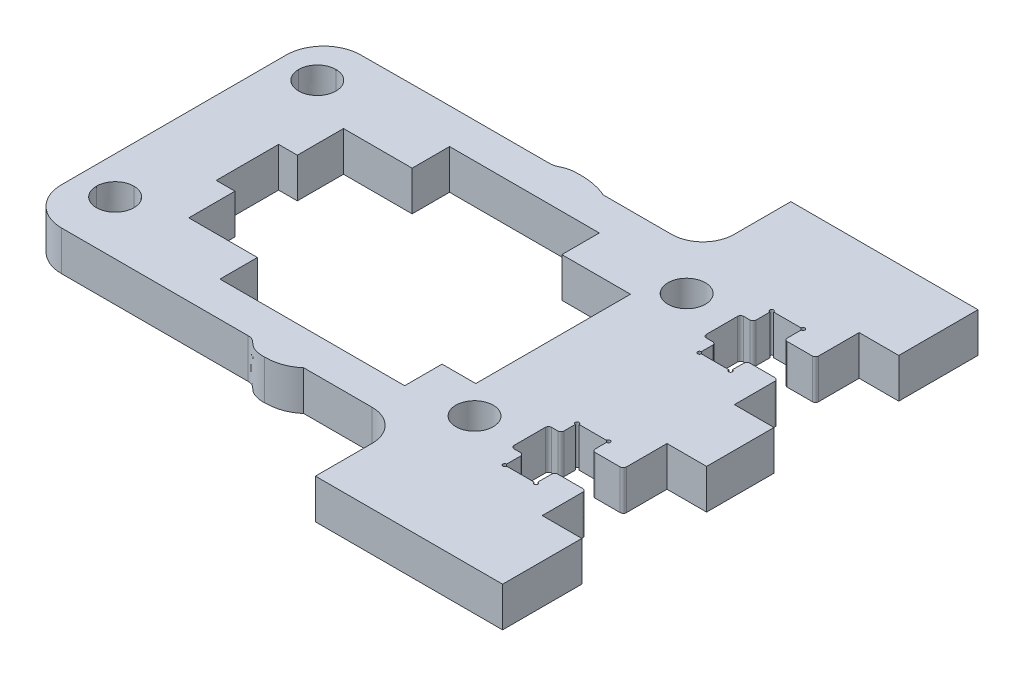
from build123d import *

# Parameters (mm, degrees)
SKETCH1_R           = 1.4998
SKETCH1_R_2         = 1.499900003
BOSS_EXTRUDE1_DEPTH = 3.175


with BuildPart() as part:
    # Sketch1 → Boss-Extrude1 (new body)
    with BuildSketch(Plane(origin=(0, 0, 0), x_dir=(1, 0, 0), z_dir=(0, 1, 0))):
        with BuildLine():
            Line((141.909960584, 37.680418232), (156.909960584, 37.680418232))
            Line((156.909960584, 37.680418232), (156.909960584, 31.330418232))
            Line((156.909960584, 31.330418232), (153.734960584, 31.330418232))
            Line((153.734960584, 31.330418232), (153.734960584, 28.080256219))
            ThreePointArc((153.734960584, 28.080256219), (153.66173728, 27.903479523), (153.484960584, 27.830256219))
            Line((153.484960584, 27.830256219), (151.484960584, 27.830256219))
            ThreePointArc((151.484960584, 27.830256219), (151.308183889, 27.903479523), (151.234960584, 28.080256219))
            Line((151.234960584, 28.080256219), (151.234960584, 29.126094713))
            Line((151.234960584, 29.126094713), (151.234960584, 29.180250843))
            ThreePointArc((151.234960584, 29.180250843), (151.341026602, 29.43631686), (151.084960584, 29.330250843))
            Line((151.084960584, 29.330250843), (150.975152963, 29.330250843))
            Line((150.975152963, 29.330250843), (148.884960584, 29.330250843))
            ThreePointArc((148.884960584, 29.330250843), (148.628894567, 29.43631686), (148.734960584, 29.180250843))
            Line((148.734960584, 29.180250843), (148.734960584, 29.126094713))
            Line((148.734960584, 29.126094713), (148.734960584, 28.080256219))
            ThreePointArc((148.734960584, 28.080256219), (148.66173728, 27.903479523), (148.484960584, 27.830256219))
            Line((148.484960584, 27.830256219), (147.984960584, 27.830256219))
            ThreePointArc((147.984960584, 27.830256219), (147.808183889, 27.757032914), (147.734960584, 27.580256219))
            Line((147.734960584, 27.580256219), (147.734960584, 25.080256219))
            ThreePointArc((147.734960584, 25.080256219), (147.808183889, 24.903479523), (147.984960584, 24.830256219))
            Line((147.984960584, 24.830256219), (148.484960584, 24.830256219))
            ThreePointArc((148.484960584, 24.830256219), (148.66173728, 24.757032914), (148.734960584, 24.580256219))
            Line((148.734960584, 24.580256219), (148.734960584, 23.755250843))
            Line((148.734960584, 23.755250843), (148.734960584, 23.680250843))
            ThreePointArc((148.734960584, 23.680250843), (148.628894567, 23.424184826), (148.884960584, 23.530250843))
            Line((148.884960584, 23.530250843), (150.975152963, 23.530250843))
            Line((150.975152963, 23.530250843), (151.084960584, 23.530250843))
            ThreePointArc((151.084960584, 23.530250843), (151.341026602, 23.424184826), (151.234960584, 23.680250843))
            Line((151.234960584, 23.680250843), (151.234960584, 23.755250843))
            Line((151.234960584, 23.755250843), (151.234960584, 24.580256219))
            ThreePointArc((151.234960584, 24.580256219), (151.308183889, 24.757032914), (151.484960584, 24.830256219))
            Line((151.484960584, 24.830256219), (153.484960584, 24.830256219))
            ThreePointArc((153.484960584, 24.830256219), (153.66173728, 24.757032914), (153.734960584, 24.580256219))
            Line((153.734960584, 24.580256219), (153.734960584, 21.330418232))
            Line((153.734960584, 21.330418232), (156.909960584, 21.330418232))
            Line((156.909960584, 21.330418232), (156.909960584, 15.930418232))
            Line((156.909960584, 15.930418232), (153.734960584, 15.930418232))
            Line((153.734960584, 15.930418232), (153.734960584, 12.680418232))
            ThreePointArc((153.734960584, 12.680418232), (153.66173728, 12.503641537), (153.484960584, 12.430418232))
            Line((153.484960584, 12.430418232), (151.484960584, 12.430418232))
            ThreePointArc((151.484960584, 12.430418232), (151.308183889, 12.503641537), (151.234960584, 12.680418232))
            Line((151.234960584, 12.680418232), (151.234960584, 13.505423608))
            Line((151.234960584, 13.505423608), (151.234960584, 13.580423608))
            ThreePointArc((151.234960584, 13.580423608), (151.341026602, 13.836489625), (151.084960584, 13.730423608))
            Line((151.084960584, 13.730423608), (150.975152963, 13.730423608))
            Line((150.975152963, 13.730423608), (148.884960584, 13.730423608))
            ThreePointArc((148.884960584, 13.730423608), (148.628894567, 13.836489625), (148.734960584, 13.580423608))
            Line((148.734960584, 13.580423608), (148.734960584, 13.505423608))
            Line((148.734960584, 13.505423608), (148.734960584, 12.680418232))
            ThreePointArc((148.734960584, 12.680418232), (148.66173728, 12.503641537), (148.484960584, 12.430418232))
            Line((148.484960584, 12.430418232), (147.984960584, 12.430418232))
            ThreePointArc((147.984960584, 12.430418232), (147.808183889, 12.357194928), (147.734960584, 12.180418232))
            Line((147.734960584, 12.180418232), (147.734960584, 9.680418232))
            ThreePointArc((147.734960584, 9.680418232), (147.808183889, 9.503641537), (147.984960584, 9.430418232))
            Line((147.984960584, 9.430418232), (148.484960584, 9.430418232))
            ThreePointArc((148.484960584, 9.430418232), (148.66173728, 9.357194928), (148.734960584, 9.180418232))
            Line((148.734960584, 9.180418232), (148.734960584, 8.134579738))
            Line((148.734960584, 8.134579738), (148.734960584, 8.080423608))
            ThreePointArc((148.734960584, 8.080423608), (148.628894567, 7.824357591), (148.884960584, 7.930423608))
            Line((148.884960584, 7.930423608), (150.975152963, 7.930423608))
            Line((150.975152963, 7.930423608), (151.084960584, 7.930423608))
            ThreePointArc((151.084960584, 7.930423608), (151.341026602, 7.824357591), (151.234960584, 8.080423608))
            Line((151.234960584, 8.080423608), (151.234960584, 8.134579738))
            Line((151.234960584, 8.134579738), (151.234960584, 9.180418232))
            ThreePointArc((151.234960584, 9.180418232), (151.308183889, 9.357194928), (151.484960584, 9.430418232))
            Line((151.484960584, 9.430418232), (153.484960584, 9.430418232))
            ThreePointArc((153.484960584, 9.430418232), (153.66173728, 9.357194928), (153.734960584, 9.180418232))
            Line((153.734960584, 9.180418232), (153.734960584, 5.930418232))
            Line((153.734960584, 5.930418232), (156.909960584, 5.930418232))
            Line((156.909960584, 5.930418232), (156.909960584, -0.419581768))
            Line((156.909960584, -0.419581768), (141.909960584, -0.419581768))
            Line((141.909960584, -0.419581768), (141.909960584, 4.130537226))
            ThreePointArc((141.909960584, 4.130537226), (141.177727537, 5.898304179), (139.409960584, 6.630537226))
            Line((139.409960584, 6.630537226), (133.909960584, 6.630537226))
            add(Edge.make_bspline(
                [(133.909960584, 6.630537226), (132.982260584, 5.801937226), (131.588760584, 5.801937226)],
                knots=[0.647058824, 0.647058824, 0.647058824, 0.705882353, 0.705882353, 0.705882353], degree=2))
            add(Edge.make_bspline(
                [(131.588760584, 5.801937226), (130.078160584, 5.801937226), (130.269860584, 6.630537226), (129.469560584, 6.630537226)],
                knots=[0.705882353, 0.705882353, 0.705882353, 0.705882353, 0.764705882, 0.764705882, 0.764705882, 0.764705882], degree=3))
            add(Edge.make_bspline(
                [(129.469560584, 6.630537226), (123.742760584, 6.630537226), (114.509960584, 6.630537226)],
                knots=[0.764705882, 0.764705882, 0.764705882, 0.823529412, 0.823529412, 0.823529412], degree=2))
            add(Edge.make_bspline(
                [(114.509960584, 6.630537226), (113.714360584, 6.630537226), (112.951360584, 6.946537226), (112.388760584, 7.509137226)],
                knots=[0.823529412, 0.823529412, 0.823529412, 0.823529412, 0.882352941, 0.882352941, 0.882352941, 0.882352941], degree=3))
            add(Edge.make_bspline(
                [(112.388760584, 7.509137226), (111.826160584, 8.071737226), (111.509960584, 8.834837226), (111.509960584, 9.630537226)],
                knots=[0.882352941, 0.882352941, 0.882352941, 0.882352941, 1, 1, 1, 1], degree=3))
            Line((111.509960584, 9.630537226), (111.509960584, 27.630337226))
            add(Edge.make_bspline(
                [(111.509960584, 27.630337226), (111.509960584, 28.425937226), (111.826160584, 29.189037226), (112.388760584, 29.751637226)],
                knots=[0.058823529, 0.058823529, 0.058823529, 0.058823529, 0.117647059, 0.117647059, 0.117647059, 0.117647059], degree=3))
            add(Edge.make_bspline(
                [(112.388760584, 29.751637226), (112.951360584, 30.314237226), (113.714360584, 30.630337226), (114.509960584, 30.630337226)],
                knots=[0.117647059, 0.117647059, 0.117647059, 0.117647059, 0.176470588, 0.176470588, 0.176470588, 0.176470588], degree=3))
            add(Edge.make_bspline(
                [(114.509960584, 30.630337226), (114.497160584, 30.650837226), (123.834160584, 30.675137226), (129.557760584, 30.665837226)],
                knots=[0.176470588, 0.176470588, 0.176470588, 0.176470588, 0.235294118, 0.235294118, 0.235294118, 0.235294118], degree=3))
            add(Edge.make_bspline(
                [(129.557760584, 30.665837226), (130.304960584, 30.664637226), (130.243960584, 31.102237226), (131.588760584, 31.102237226)],
                knots=[0.235294118, 0.235294118, 0.235294118, 0.235294118, 0.294117647, 0.294117647, 0.294117647, 0.294117647], degree=3))
            add(Edge.make_bspline(
                [(131.588760584, 31.102237226), (133.000560584, 31.102237226), (133.900960584, 30.644837226), (133.909960584, 30.630337226)],
                knots=[0.294117647, 0.294117647, 0.294117647, 0.294117647, 0.352941176, 0.352941176, 0.352941176, 0.352941176], degree=3))
            Line((133.909960584, 30.630337226), (139.409960584, 30.630337226))
            ThreePointArc((139.409960584, 30.630337226), (141.177727537, 31.362570273), (141.909960584, 33.130337226))
            Line((141.909960584, 33.130337226), (141.909960584, 37.680418232))
        make_face()
        with Locations(Location((144.109960584, 10.130437226, 0), (0, 0, 270))):
            Circle(SKETCH1_R, mode=Mode.SUBTRACT)
        with Locations(Location((144.110060584, 27.130337226, 0), (0, 0, 270))):
            Circle(SKETCH1_R_2, mode=Mode.SUBTRACT)
        Polygon((141.909960584, 24.830337226), (141.909960584, 12.430337226), (139.209960584, 12.430337226), (139.209960584, 9.430537226), (124.409960584, 9.430537226), (124.409960584, 12.430337226), (118.909960584, 12.430337226), (118.909960584, 16.130337226), (117.410060584, 16.130337226), (117.410060584, 21.130337226), (118.909960584, 21.130337226), (118.909960584, 24.830337226), (124.409960584, 24.830337226), (124.409960584, 27.830337226), (136.409960584, 27.830337226), (136.409960584, 24.830337226), align=None, mode=Mode.SUBTRACT)
        with BuildLine():
            add(Edge.make_bspline(
                [(116.009960584, 27.130337226), (116.009960584, 26.301837226), (115.338460584, 25.630337226), (114.510060584, 25.630337226)],
                knots=[0, 0, 0, 0, 0.2, 0.2, 0.2, 0.2], degree=3))
            add(Edge.make_bspline(
                [(114.510060584, 25.630337226), (113.681560584, 25.630237226), (113.010060584, 26.301837226), (113.010060584, 27.130237226)],
                knots=[0.2, 0.2, 0.2, 0.2, 0.4, 0.4, 0.4, 0.4], degree=3))
            add(Edge.make_bspline(
                [(113.010060584, 27.130237226), (113.009960584, 27.958737226), (113.681560584, 28.630237226), (114.509960584, 28.630337226)],
                knots=[0.4, 0.4, 0.4, 0.4, 0.6, 0.6, 0.6, 0.6], degree=3))
            add(Edge.make_bspline(
                [(114.509960584, 28.630337226), (115.338460584, 28.630337226), (116.009960584, 27.958737226), (116.009960584, 27.130337226)],
                knots=[0.6, 0.6, 0.6, 0.6, 1, 1, 1, 1], degree=3))
        make_face(mode=Mode.SUBTRACT)
        with BuildLine():
            add(Edge.make_bspline(
                [(116.009960584, 10.930618232), (116.009960584, 10.102218232), (115.338360584, 9.430518232), (114.510060584, 9.430518232)],
                knots=[0, 0, 0, 0, 0.2, 0.2, 0.2, 0.2], degree=3))
            add(Edge.make_bspline(
                [(114.510060584, 9.430518232), (113.681660584, 9.430518232), (113.009960584, 10.102218232), (113.009960584, 10.930518232)],
                knots=[0.2, 0.2, 0.2, 0.2, 0.4, 0.4, 0.4, 0.4], degree=3))
            add(Edge.make_bspline(
                [(113.009960584, 10.930518232), (113.009960584, 11.758918232), (113.681660584, 12.430418232), (114.509960584, 12.430418232)],
                knots=[0.4, 0.4, 0.4, 0.4, 0.6, 0.6, 0.6, 0.6], degree=3))
            add(Edge.make_bspline(
                [(114.509960584, 12.430418232), (115.338360584, 12.430418232), (116.009960584, 11.758918232), (116.009960584, 10.930618232)],
                knots=[0.6, 0.6, 0.6, 0.6, 1, 1, 1, 1], degree=3))
        make_face(mode=Mode.SUBTRACT)
    extrude(amount=BOSS_EXTRUDE1_DEPTH)


solid = part.part
